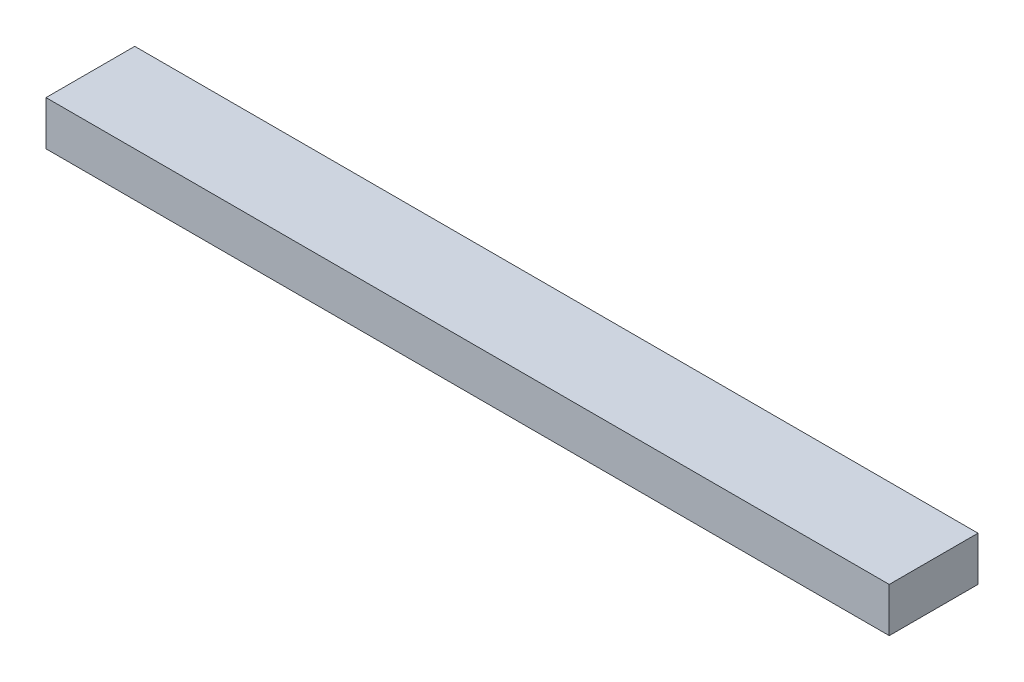
from build123d import *

# Parameters (mm, degrees)
SKETCH1_W           = 241.3
SKETCH1_H           = 25.4
BOSS_EXTRUDE1_DEPTH = 12.7


with BuildPart() as part:
    # Sketch1 → Boss-Extrude1 (new body)
    with BuildSketch(Plane(origin=(0, 0, 0), x_dir=(1, 0, 0), z_dir=(0, 1, 0))):
        with Locations((120.65, 12.7)):
            Rectangle(SKETCH1_W, SKETCH1_H)
    extrude(amount=BOSS_EXTRUDE1_DEPTH)


solid = part.part
